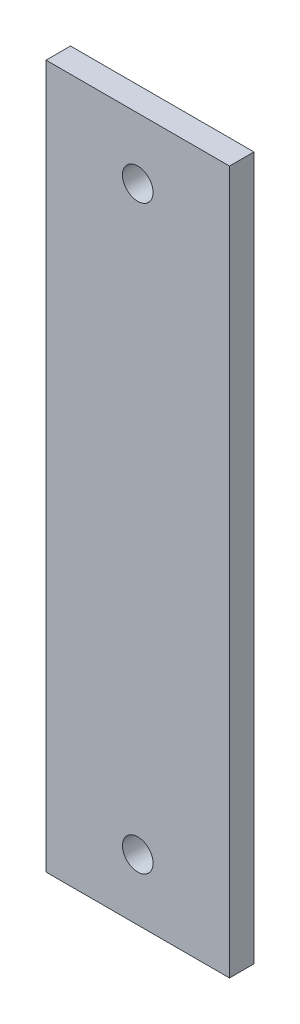
from build123d import *

# Parameters (mm, degrees)
ESQUISSE1_W        = 30
ESQUISSE1_H        = 115
ESQUISSE1_R        = 2.5
BOSS_EXTRU_1_DEPTH = 4


with BuildPart() as part:
    # Esquisse1 → Boss.-Extru.1 (new body)
    with BuildSketch(Plane.XY):
        Rectangle(ESQUISSE1_W, ESQUISSE1_H)
        with Locations((0, 47.5)):
            Circle(ESQUISSE1_R, mode=Mode.SUBTRACT)
        with Locations(Location((0, -47.5, 0), (0, 0, 180))):
            Circle(ESQUISSE1_R, mode=Mode.SUBTRACT)
    extrude(amount=BOSS_EXTRU_1_DEPTH)


solid = part.part
